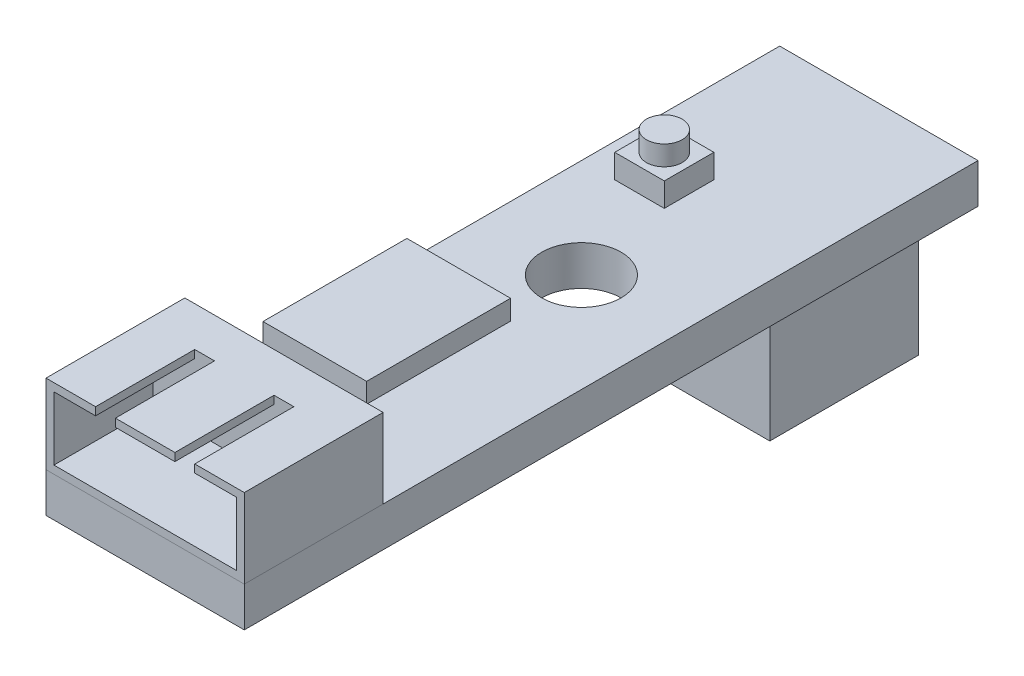
from build123d import *

# Parameters (mm, degrees)
SKETCH_1_W          = 10
SKETCH_1_H          = 37
EXTRUDE_1_DEPTH     = 2
SKETCH_2_W          = 10
SKETCH_2_H          = 7
EXTRUDE_2_DEPTH     = 4
CUT_EXTRUDE_1_DEPTH = 5
SKETCH_4_R          = 2
CUT_EXTRUDE_2_DEPTH = 5
EXTRUDE_3_DEPTH     = 7
SKETCH_6_W          = 5.227328637
SKETCH_6_H          = 7.258677384
EXTRUDE_4_DEPTH     = 1
SKETCH_7_W          = 2.5
SKETCH_7_H          = 2.5
EXTRUDE_5_DEPTH     = 1.2
SKETCH_8_R          = 0.9
EXTRUDE_6_DEPTH     = 1
SKETCH_9_R          = 1.5
CUT_EXTRUDE_3_DEPTH = 1


with BuildPart() as part:
    # 草图1 → 凸台-拉伸1 (new body)
    with BuildSketch(Plane(origin=(0, 0, 0), x_dir=(1, 0, 0), z_dir=(0, 1, 0))):
        Rectangle(SKETCH_1_W, SKETCH_1_H)
    extrude(amount=EXTRUDE_1_DEPTH)

    # 草图4 → 切除-拉伸2 (cut)
    with BuildSketch(Plane.XZ):
        with Locations((0, -3.5)):
            Circle(SKETCH_4_R)
    extrude(amount=-CUT_EXTRUDE_2_DEPTH, mode=Mode.SUBTRACT)

    # 草图5 → 凸台-拉伸3 (add)
    with BuildSketch(Plane.XZ):
        Polygon((-2, -10), (3, -10), (3, -17.5), (-3, -17.5), (-3, -11), align=None)
    extrude(amount=EXTRUDE_3_DEPTH)

    # 草图6 → 凸台-拉伸4 (add)
    with BuildSketch(Plane(origin=(0, 2, 0), x_dir=(1, 0, 0), z_dir=(0, 1, 0))):
        with Locations((-2.386335681, -3.929338472)):
            Rectangle(SKETCH_6_W, SKETCH_6_H)
    extrude(amount=EXTRUDE_4_DEPTH)

    # 草图9 → 切除-拉伸3 (cut)
    with BuildSketch(Plane.XZ.offset(7)):
        with Locations((0, -12)):
            Circle(SKETCH_9_R)
        with Locations((0, -15.6)):
            Circle(SKETCH_9_R)
    extrude(amount=-CUT_EXTRUDE_3_DEPTH, mode=Mode.SUBTRACT)

    # 草图10 → 旋转1 (revolve)
    with BuildSketch(Plane(origin=(0, 0, 0), x_dir=(0, -1, 0), z_dir=(1, 0, 0))):
        with BuildLine():
            Line((6, 12), (6.691796367, 12))
            add(Edge.make_bspline(
                [(6, 10.5), (6.763042872, 11.099552197), (6.691796367, 12)],
                knots=[0, 0, 0, 1, 1, 1], degree=2))
            Line((6, 10.5), (6, 12))
        make_face()
    revolve(axis=Axis((0, -6, -12), (0, -1, 0)))

    # 草图11 → 旋转2 (revolve)
    with BuildSketch(Plane(origin=(0, 0, 0), x_dir=(0, -1, 0), z_dir=(1, 0, 0))):
        with BuildLine():
            Line((6, 14.1), (6, 15.6))
            Line((6, 15.6), (6.699650248, 15.6))
            add(Edge.make_bspline(
                [(6, 14.1), (6.724602688, 14.677179589), (6.699650248, 15.6)],
                knots=[0, 0, 0, 1, 1, 1], degree=2))
        make_face()
    revolve(axis=Axis((0, -6, -15.6), (0, -1, 0)))


with BuildPart() as body_2:
    # 草图2 → 凸台-拉伸2 (new body)
    with BuildSketch(Plane(origin=(0, 2, 0), x_dir=(1, 0, 0), z_dir=(0, 1, 0))):
        with Locations((0, -15)):
            Rectangle(SKETCH_2_W, SKETCH_2_H)
    extrude(amount=EXTRUDE_2_DEPTH)

    # 草图3 → 切除-拉伸1 (cut)
    with BuildSketch(Plane.XY.offset(18.5)):
        Polygon((1.5, 6), (1.5, 5.6), (-1.5, 5.6), (-1.5, 6), (-2.5, 6), (-2.5, 5.6), (-4.6, 5.6), (-4.6, 2.4), (4.6, 2.4), (4.6, 5.6), (2.5, 5.6), (2.5, 6), align=None)
    extrude(amount=-CUT_EXTRUDE_1_DEPTH, mode=Mode.SUBTRACT)


with BuildPart() as body_3:
    # 草图7 → 凸台-拉伸5 (new body)
    with BuildSketch(Plane(origin=(0, 2, 0), x_dir=(1, 0, 0), z_dir=(0, 1, 0))):
        with Locations((-2.070135445, 9.75)):
            Rectangle(SKETCH_7_W, SKETCH_7_H)
    extrude(amount=EXTRUDE_5_DEPTH)


with BuildPart() as body_4:
    # 草图8 → 凸台-拉伸6 (new body)
    with BuildSketch(Plane(origin=(0, 3.2, 0), x_dir=(1, 0, 0), z_dir=(0, 1, 0))):
        with Locations((-2.070135445, 9.75)):
            Circle(SKETCH_8_R)
    extrude(amount=EXTRUDE_6_DEPTH)


solid = Compound([part.part, body_2.part, body_3.part, body_4.part])
